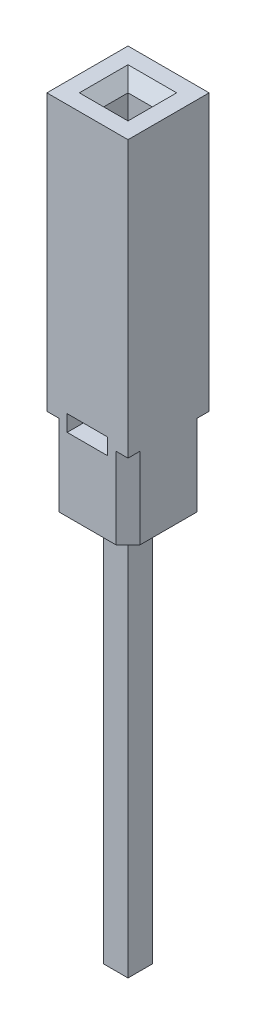
from build123d import *

# Parameters (mm, degrees)
ESQUISSE1_W             = 8.382
ESQUISSE1_H             = 2.54
BOSS_EXTRU_1_DEPTH      = 1.905
ESQUISSE2_W             = 0.635
ESQUISSE2_H             = 2.54
BOSS_EXTRU_2_DEPTH      = 0.508
ESQUISSE3_W             = 0.762
ESQUISSE3_H             = 0.762
BOSS_EXTRU_3_DEPTH      = 0.508
ESQUISSE4_W             = 1.905
ESQUISSE4_H             = 2.54
BOSS_EXTRU_4_DEPTH      = 2.286
ESQUISSE5_W             = 2.54
ESQUISSE5_H             = 11.176
BOSS_EXTRU_5_DEPTH      = 0.635
ESQUISSE6_R             = 0.538815367
BOSS_EXTRU_6_DEPTH      = 0.254
ESQUISSE7_W             = 0.762
ESQUISSE7_H             = 0.762
BOSS_EXTRU_7_DEPTH      = 12.446
ENL_V_MAT_EXTRU_1_DEPTH = 2.54
ENL_V_MAT_EXTRU_2_DEPTH = 2.54
ENL_V_MAT_EXTRU_3_DEPTH = 2.54
ENL_V_MAT_EXTRU_4_DEPTH = 2.54
ESQUISSE12_W            = 0.762
ESQUISSE12_H            = 0.762
ENL_V_MAT_EXTRU_5_DEPTH = 7.62
CHANFREIN1_SIZE         = 0.254
CHANFREIN2_SIZE         = 0.381


with BuildPart() as part:
    # Esquisse1 → Boss.-Extru.1 (new body)
    with BuildSketch(Plane(origin=(-1.27, 0, 0), x_dir=(0, -1, 0), z_dir=(-1, 0, 0))):
        with Locations((-6.985, 0)):
            Rectangle(ESQUISSE1_W, ESQUISSE1_H)
    extrude(amount=-BOSS_EXTRU_1_DEPTH)

    # Esquisse2 → Boss.-Extru.2 (add)
    with BuildSketch(Plane.XZ.offset(-2.794)):
        with Locations((-0.9525, 0)):
            Rectangle(ESQUISSE2_W, ESQUISSE2_H)
    extrude(amount=BOSS_EXTRU_2_DEPTH)

    # Esquisse3 → Boss.-Extru.3 (add)
    with BuildSketch(Plane.XZ.offset(-2.794)):
        Rectangle(ESQUISSE3_W, ESQUISSE3_H)
    extrude(amount=BOSS_EXTRU_3_DEPTH)

    # Esquisse4 → Boss.-Extru.4 (add)
    with BuildSketch(Plane.XZ.offset(-2.286)):
        with Locations((-0.3175, 0)):
            Rectangle(ESQUISSE4_W, ESQUISSE4_H)
    extrude(amount=BOSS_EXTRU_4_DEPTH)

    # Esquisse5 → Boss.-Extru.5 (add)
    with BuildSketch(Plane(origin=(0.635, 0, 0), x_dir=(0, 0, -1), z_dir=(1, 0, 0))):
        with Locations((0, 5.588)):
            Rectangle(ESQUISSE5_W, ESQUISSE5_H)
    extrude(amount=BOSS_EXTRU_5_DEPTH)

    # Esquisse6 → Boss.-Extru.6 (add)
    with BuildSketch(Plane.XZ):
        with Locations(Location((0, 0, 0), (0, 0, 90))):
            Circle(ESQUISSE6_R)
    extrude(amount=BOSS_EXTRU_6_DEPTH)

    # Esquisse7 → Boss.-Extru.7 (add)
    with BuildSketch(Plane.XZ.offset(0.254)):
        Rectangle(ESQUISSE7_W, ESQUISSE7_H)
    extrude(amount=BOSS_EXTRU_7_DEPTH)

    # Esquisse8 → Enlèv. mat.-Extru.1 (cut)
    with BuildSketch(Plane.XZ):
        Polygon((-1.27, 1.27), (-1.27, 0.889), (-0.889, 1.27), align=None)
    extrude(amount=-ENL_V_MAT_EXTRU_1_DEPTH, mode=Mode.SUBTRACT)

    # Esquisse9 → Enlèv. mat.-Extru.2 (cut)
    with BuildSketch(Plane.XZ):
        Polygon((-1.27, -1.27), (-0.889, -1.27), (-1.27, -0.889), align=None)
    extrude(amount=-ENL_V_MAT_EXTRU_2_DEPTH, mode=Mode.SUBTRACT)

    # Esquisse10 → Enlèv. mat.-Extru.3 (cut)
    with BuildSketch(Plane.XZ):
        Polygon((1.27, 1.27), (0.889, 1.27), (1.27, 0.889), align=None)
    extrude(amount=-ENL_V_MAT_EXTRU_3_DEPTH, mode=Mode.SUBTRACT)

    # Esquisse11 → Enlèv. mat.-Extru.4 (cut)
    with BuildSketch(Plane.XZ):
        Polygon((1.27, -1.27), (1.27, -0.889), (0.889, -1.27), align=None)
    extrude(amount=-ENL_V_MAT_EXTRU_4_DEPTH, mode=Mode.SUBTRACT)

    # Esquisse12 → Enlèv. mat.-Extru.5 (cut)
    with BuildSketch(Plane(origin=(0, 11.176, 0), x_dir=(-1, 0, 0), z_dir=(0, 1, 0))):
        Rectangle(ESQUISSE12_W, ESQUISSE12_H)
    extrude(amount=-ENL_V_MAT_EXTRU_5_DEPTH, mode=Mode.SUBTRACT)

    # Chanfrein1
    chanfrein1_edges = [part.edges().sort_by_distance(p)[0] for p in [
        (0.381, -12.7, 0),
        (0, -12.7, 0.381),
        (-0.381, -12.7, 0),
        (0, -12.7, -0.381),
    ]]
    chamfer(chanfrein1_edges, length=CHANFREIN1_SIZE)

    # Chanfrein2
    chanfrein2_edges = [part.edges().sort_by_distance(p)[0] for p in [
        (0, 11.176, 0.381),
        (0.381, 11.176, 0),
        (0, 11.176, -0.381),
        (-0.381, 11.176, 0),
    ]]
    chamfer(chanfrein2_edges, length=CHANFREIN2_SIZE)


solid = part.part
